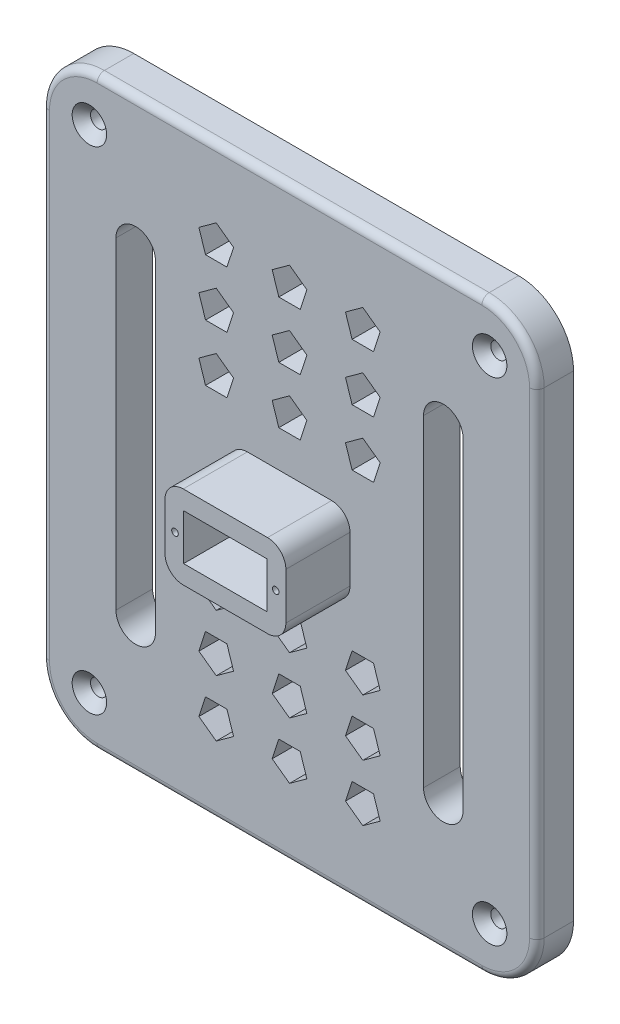
from build123d import *

# Parameters (mm, degrees)
BOSS_EXTRUDE1_DEPTH                                 = 10
CSK_FOR_M4_COUNTERSUNK_FLAT_HEAD_SCREW1_D           = 4.4
CSK_FOR_M4_COUNTERSUNK_FLAT_HEAD_SCREW1_DEPTH       = 10
CSK_FOR_M4_COUNTERSUNK_FLAT_HEAD_SCREW1_CSINK_D     = 9.4
CSK_FOR_M4_COUNTERSUNK_FLAT_HEAD_SCREW1_CSINK_ANGLE = 90
CSK_FOR_M4_COUNTERSUNK_FLAT_HEAD_SCREW1_TIP         = 1.321893362
SKETCH4_W                                           = 33
SKETCH4_H                                           = 22.7
SKETCH4_W_2                                         = 22.8
SKETCH4_H_2                                         = 12.5
EXTRUDE_THIN1_DEPTH                                 = 17.5
FILLET1_R                                           = 5
F_1_5MM_DOWEL_HOLE1_D                               = 1.8
F_1_5MM_DOWEL_HOLE1_DEPTH                           = 10
F_1_5MM_DOWEL_HOLE1_TIP                             = 0.540774557
SKETCH8_W                                           = 3
SKETCH8_H                                           = 12.5
CUT_EXTRUDE1_DEPTH                                  = 100.184172124
BOSS_EXTRUDE3_DEPTH                                 = 10
FILLET2_R                                           = 2


with BuildPart() as part:
    # Sketch1 → Boss-Extrude1 (new body)
    with BuildSketch(Plane(origin=(0, 0, 0), x_dir=(0, 1, 0), z_dir=(0, 0, 1))):
        with BuildLine():
            Line((-60, 62.5), (60, 62.5))
            ThreePointArc((60, 62.5), (70.606601718, 58.106601718), (75, 47.5))
            Line((75, 47.5), (75, -47.5))
            ThreePointArc((75, -47.5), (70.606601718, -58.106601718), (60, -62.5))
            Line((60, -62.5), (-60, -62.5))
            ThreePointArc((-60, -62.5), (-70.606601718, -58.106601718), (-75, -47.5))
            Line((-75, -47.5), (-75, 47.5))
            ThreePointArc((-75, 47.5), (-70.606601718, 58.106601718), (-60, 62.5))
        make_face()
    extrude(amount=BOSS_EXTRUDE1_DEPTH)

    # CSK for M4 Countersunk Flat Head Screw1
    with Locations(Plane(origin=(0, 0, 10), x_dir=(0, -1, 0), z_dir=(0, 0, 1))):
        with Locations((-67.11, 54.61), (67.11, 54.61), (67.11, -54.61), (-67.11, -54.61)):
            CounterSinkHole(CSK_FOR_M4_COUNTERSUNK_FLAT_HEAD_SCREW1_D / 2, CSK_FOR_M4_COUNTERSUNK_FLAT_HEAD_SCREW1_CSINK_D / 2, depth=CSK_FOR_M4_COUNTERSUNK_FLAT_HEAD_SCREW1_DEPTH, counter_sink_angle=CSK_FOR_M4_COUNTERSUNK_FLAT_HEAD_SCREW1_CSINK_ANGLE)
            with Locations((0, 0, -(CSK_FOR_M4_COUNTERSUNK_FLAT_HEAD_SCREW1_DEPTH + CSK_FOR_M4_COUNTERSUNK_FLAT_HEAD_SCREW1_TIP / 2))):  # 118° drill point
                Cone(0, CSK_FOR_M4_COUNTERSUNK_FLAT_HEAD_SCREW1_D / 2, CSK_FOR_M4_COUNTERSUNK_FLAT_HEAD_SCREW1_TIP, mode=Mode.SUBTRACT)

    # Sketch4 → Extrude-Thin1 (add)
    with BuildSketch(Plane.XY.offset(10)):
        Rectangle(SKETCH4_W, SKETCH4_H)
        Rectangle(SKETCH4_W_2, SKETCH4_H_2, mode=Mode.SUBTRACT)
    extrude(amount=EXTRUDE_THIN1_DEPTH)

    # Fillet1
    fillet1_edges = [part.edges().sort_by_distance(p)[0] for p in [
        (16.5, -11.35, 18.75),
        (16.5, 11.35, 18.75),
        (-16.5, 11.35, 18.75),
        (-16.5, -11.35, 18.75),
    ]]
    fillet(fillet1_edges, radius=FILLET1_R)

    # Ø1.5mm Dowel Hole1
    with Locations(Plane(origin=(0, 0, 27.5), x_dir=(0, -1, 0), z_dir=(0, 0, 1))):
        with Locations((0, -13.75), (0, 13.75)):
            Hole(F_1_5MM_DOWEL_HOLE1_D / 2, depth=F_1_5MM_DOWEL_HOLE1_DEPTH)
            with Locations((0, 0, -(F_1_5MM_DOWEL_HOLE1_DEPTH + F_1_5MM_DOWEL_HOLE1_TIP / 2))):  # 118° drill point
                Cone(0, F_1_5MM_DOWEL_HOLE1_D / 2, F_1_5MM_DOWEL_HOLE1_TIP, mode=Mode.SUBTRACT)

    # Sketch8 → Cut-Extrude1 (cut, through all)
    with BuildSketch(Plane.XY.offset(10)):
        with BuildLine():
            Line((-47.370334328, 43.972462246), (-47.370334328, -43.972462246))
            ThreePointArc((-47.370334328, -43.972462246), (-41.973713961, -49.369082612), (-36.577093595, -43.972462245))
            Line((-36.577093595, -43.972462245), (-36.577093595, 43.972462246))
            ThreePointArc((-36.577093595, 43.972462246), (-41.973713962, 49.369082612), (-47.370334328, 43.972462246))
        make_face()
        with BuildLine():
            Line((36.577093595, 43.972462246), (36.577093595, -43.972462245))
            ThreePointArc((36.577093595, -43.972462245), (41.973713961, -49.369082612), (47.370334328, -43.972462246))
            Line((47.370334328, -43.972462246), (47.370334328, 43.972462246))
            ThreePointArc((47.370334328, 43.972462246), (41.973713962, 49.369082612), (36.577093595, 43.972462246))
        make_face()
        Polygon((20, 61.232201212), (15.268419991, 57.794507111), (17.075722734, 52.232201212), (22.924277266, 52.232201212), (24.731580009, 57.794507111), align=None)
        Polygon((0, 61.232201212), (-4.731580009, 57.794507111), (-2.924277266, 52.232201212), (2.924277266, 52.232201212), (4.731580009, 57.794507111), align=None)
        with Locations((-9.9, 0)):
            Rectangle(SKETCH8_W, SKETCH8_H)
        Polygon((20, 45.791100606), (15.268419991, 42.353406505), (17.075722734, 36.791100606), (22.924277266, 36.791100606), (24.731580009, 42.353406505), align=None)
        Polygon((20, 30.35), (15.268419991, 26.912305899), (17.075722734, 21.35), (22.924277266, 21.35), (24.731580009, 26.912305899), align=None)
        Polygon((0, 45.791100606), (-4.731580009, 42.353406505), (-2.924277266, 36.791100606), (2.924277266, 36.791100606), (4.731580009, 42.353406505), align=None)
        Polygon((0, 30.35), (-4.731580009, 26.912305899), (-2.924277266, 21.35), (2.924277266, 21.35), (4.731580009, 26.912305899), align=None)
        Polygon((-24.731580009, 26.912305899), (-20, 30.35), (-15.268419991, 26.912305899), (-17.075722734, 21.35), (-22.924277266, 21.35), align=None)
        Polygon((-24.731580009, 42.353406505), (-20, 45.791100606), (-15.268419991, 42.353406505), (-17.075722734, 36.791100606), (-22.924277266, 36.791100606), align=None)
        Polygon((-24.731580009, 57.794507111), (-20, 61.232201212), (-15.268419991, 57.794507111), (-17.075722734, 52.232201212), (-22.924277266, 52.232201212), align=None)
        Polygon((24.731580009, -26.912305899), (20, -30.35), (15.268419991, -26.912305899), (17.075722734, -21.35), (22.924277266, -21.35), align=None)
        Polygon((4.731580009, -26.912305899), (0, -30.35), (-4.731580009, -26.912305899), (-2.924277266, -21.35), (2.924277266, -21.35), align=None)
        Polygon((-22.924277266, -21.35), (-24.731580009, -26.912305899), (-20, -30.35), (-15.268419991, -26.912305899), (-17.075722734, -21.35), align=None)
        Polygon((-22.924277266, -36.791100606), (-24.731580009, -42.353406505), (-20, -45.791100606), (-15.268419991, -42.353406505), (-17.075722734, -36.791100606), align=None)
        Polygon((4.731580009, -42.353406505), (0, -45.791100606), (-4.731580009, -42.353406505), (-2.924277266, -36.791100606), (2.924277266, -36.791100606), align=None)
        Polygon((24.731580009, -42.353406505), (20, -45.791100606), (15.268419991, -42.353406505), (17.075722734, -36.791100606), (22.924277266, -36.791100606), align=None)
        Polygon((24.731580009, -57.794507111), (20, -61.232201212), (15.268419991, -57.794507111), (17.075722734, -52.232201212), (22.924277266, -52.232201212), align=None)
        Polygon((4.731580009, -57.794507111), (0, -61.232201212), (-4.731580009, -57.794507111), (-2.924277266, -52.232201212), (2.924277266, -52.232201212), align=None)
        Polygon((-22.924277266, -52.232201212), (-24.731580009, -57.794507111), (-20, -61.232201212), (-15.268419991, -57.794507111), (-17.075722734, -52.232201212), align=None)
    extrude(amount=-CUT_EXTRUDE1_DEPTH, mode=Mode.SUBTRACT)

    # Sketch9 → Boss-Extrude3 (add)
    with BuildSketch(Plane(origin=(0, 0, 0), x_dir=(1, 0, 0), z_dir=(0, 0, -1))):
        with BuildLine():
            Line((-52.5, 80), (52.5, 80))
            ThreePointArc((52.5, 80), (63.106601718, 75.606601718), (67.5, 65))
            Line((67.5, 65), (67.5, -65))
            ThreePointArc((67.5, -65), (63.106601718, -75.606601718), (52.5, -80))
            Line((52.5, -80), (-52.5, -80))
            ThreePointArc((-52.5, -80), (-63.106601718, -75.606601718), (-67.5, -65))
            Line((-67.5, -65), (-67.5, 65))
            ThreePointArc((-67.5, 65), (-63.106601718, 75.606601718), (-52.5, 80))
        make_face()
        with BuildLine():
            Line((-47.5, 75), (47.5, 75))
            ThreePointArc((47.5, 75), (58.106601718, 70.606601718), (62.5, 60))
            Line((62.5, 60), (62.5, -60))
            ThreePointArc((62.5, -60), (58.106601718, -70.606601718), (47.5, -75))
            Line((47.5, -75), (-47.5, -75))
            ThreePointArc((-47.5, -75), (-58.106601718, -70.606601718), (-62.5, -60))
            Line((-62.5, -60), (-62.5, 60))
            ThreePointArc((-62.5, 60), (-58.106601718, 70.606601718), (-47.5, 75))
        make_face(mode=Mode.SUBTRACT)
    extrude(amount=-BOSS_EXTRUDE3_DEPTH)

    # Fillet2
    fillet2_edges = [part.edges().sort_by_distance(p)[0] for p in [
        (63.106601718, 75.606601718, 10),
        (0, 80, 10),
        (-63.106601718, 75.606601718, 10),
        (-67.5, 0, 10),
        (-63.106601718, -75.606601718, 10),
        (0, -80, 10),
        (63.106601718, -75.606601718, 10),
        (67.5, 0, 10),
    ]]
    fillet(fillet2_edges, radius=FILLET2_R)


solid = part.part
